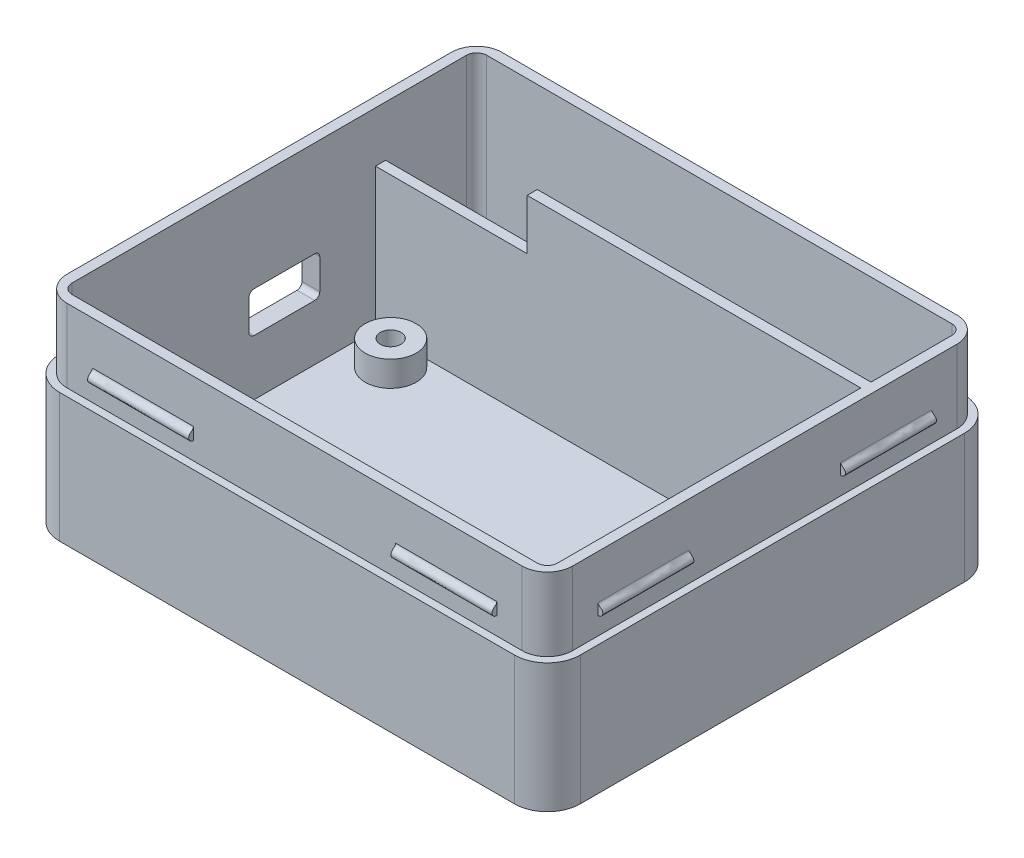
from build123d import *

# Parameters (mm, degrees)
ESQUISSE1_W             = 100
ESQUISSE1_H             = 66
BOSS_EXTRU_1_DEPTH      = 40
COQUE1_T                = -2
BOSS_EXTRU_2_DEPTH      = 40
ESQUISSE3_W             = 96
ESQUISSE3_H             = 18
BOSS_EXTRU_3_DEPTH      = 2
CONG_1_R                = 2
CONG_2_R                = 5
BOSS_EXTRU_4_START      = -10
BOSS_EXTRU_4_DEPTH      = 80
BOSS_EXTRU_5_START      = -10
BOSS_EXTRU_5_DEPTH      = 66
ESQUISSE6_W             = 30
ESQUISSE6_H             = 10
ENL_V_MAT_EXTRU_1_DEPTH = 5
ESQUISSE7_R             = 5.05
ESQUISSE7_R_2           = 5
BOSS_EXTRU_6_DEPTH      = 5
ESQUISSE8_R             = 2.05
ENL_V_MAT_EXTRU_2_DEPTH = 6.5
BOSS_EXTRU_7_START      = -25.5
BOSS_EXTRU_7_DEPTH      = 25.5
ESQUISSE11_W            = 14
ESQUISSE11_H            = 8
ENL_V_MAT_EXTRU_4_DEPTH = 10
CONG_3_R                = 1
ENL_V_START             = -11
ESQUISSE13_W            = 15.255794969
ESQUISSE13_H            = 30
ESQUISSE13_W_2          = 19.187526393
ESQUISSE13_W_3          = 40
ESQUISSE13_H_2          = 22.475627791
ESQUISSE13_H_3          = 22.031692389
ENL_V_MAT_EXTRU_6_DEPTH = 2.407546


with BuildPart() as part:
    # Esquisse1 → Boss.-Extru.1 (new body)
    with BuildSketch(Plane(origin=(0, 0, 0), x_dir=(1, 0, 0), z_dir=(0, 1, 0))):
        Rectangle(ESQUISSE1_W, ESQUISSE1_H)
    extrude(amount=BOSS_EXTRU_1_DEPTH)

    # Coque1
    coque1_openings = [part.faces().sort_by_distance(p)[0] for p in [
        (0, 40, 0),
    ]]
    offset(amount=COQUE1_T, openings=coque1_openings, kind=Kind.INTERSECTION)

    # Esquisse2 → Boss.-Extru.2 (add)
    with BuildSketch(Plane.XZ):
        Polygon((-50, -33), (-50, -53), (50, -53), (50, -33), (48, -33), (48, -51), (-48, -51), (-48, -33), align=None)
    extrude(amount=-BOSS_EXTRU_2_DEPTH)

    # Esquisse3 → Boss.-Extru.3 (add)
    with BuildSketch(Plane.XZ):
        with Locations((0, -42)):
            Rectangle(ESQUISSE3_W, ESQUISSE3_H)
    extrude(amount=-BOSS_EXTRU_3_DEPTH)

    # Congé1
    cong_1_edges = [part.edges().sort_by_distance(p)[0] for p in [
        (48, 21, 31),
        (-48, 21, 31),
        (-48, 21, -51),
        (48, 21, -51),
    ]]
    fillet(cong_1_edges, radius=CONG_1_R)

    # Congé2
    cong_2_edges = [part.edges().sort_by_distance(p)[0] for p in [
        (50, 20, -53),
        (-50, 20, -53),
        (50, 20, 33),
        (-50, 20, 33),
    ]]
    fillet(cong_2_edges, radius=CONG_2_R)

    # Esquisse4 → Boss.-Extru.4 (add)
    with BuildSketch(Plane(origin=(50, 0, 0), x_dir=(0, 0, -1), z_dir=(1, 0, 0)).offset(BOSS_EXTRU_4_START)):
        with BuildLine():
            add(Edge.make_bspline(
                [(-33.18068568, 30.983540891), (-33.200458758, 30.96131094), (-33.363431499, 30.798331001), (-33.767642681, 30.550383894), (-33.920207773, 30.167024248), (-33.940361593, 30)],
                knots=[0.143259485, 0.143259485, 0.143259485, 0.143259485, 0.176064933, 0.395847239, 0.557376167, 0.557376167, 0.557376167, 0.557376167], degree=3))
            Line((-33.940361593, 30), (-33, 30))
            Line((-33, 30), (-33, 31))
            ThreePointArc((-33, 31), (-33.090716891, 30.995876722), (-33.18068568, 30.983540891))
        make_face()
        with BuildLine():
            Line((-33, 30), (-33.940361593, 30))
            add(Edge.make_bspline(
                [(-33.940361593, 30), (-33.965852576, 29.788744152), (-33.920193726, 29.570085219), (-33.793139685, 29.390960231)],
                knots=[0.557376167, 0.557376167, 0.557376167, 0.557376167, 0.761681416, 0.761681416, 0.761681416, 0.761681416], degree=3))
            ThreePointArc((-33.793139685, 29.390960231), (-33.668435122, 29.256229547), (-33.521201899, 29.146566593))
            add(Edge.make_bspline(
                [(-33.521201899, 29.146566593), (-33.383555588, 29.067558812), (-33.210703446, 29.014663383), (-33, 29)],
                knots=[0.869901718, 0.869901718, 0.869901718, 0.869901718, 1, 1, 1, 1], degree=3))
            Line((-33, 29), (-33, 30))
        make_face()
        with BuildLine():
            add(Edge.make_bspline(
                [(-33, 31.407545579), (-33.034562351, 31.197957452), (-33.094337797, 31.080617796), (-33.18068568, 30.983540891)],
                knots=[0, 0, 0, 0, 0.143259485, 0.143259485, 0.143259485, 0.143259485], degree=3))
            ThreePointArc((-33.18068568, 30.983540891), (-33.090716891, 30.995876722), (-33, 31))
            Line((-33, 31), (-33, 31.407545579))
        make_face()
    boss_extru_4 = extrude(amount=-BOSS_EXTRU_4_DEPTH)

    # Symétrie1: Boss.-Extru.4 across plane
    add(boss_extru_4.mirror(Plane(origin=(0, 0, -10), x_dir=(1, 0, 0), z_dir=(0, 0, -1))))

    # Esquisse5 → Boss.-Extru.5 (add)
    with BuildSketch(Plane(origin=(0, 0, -53), x_dir=(-1, 0, 0), z_dir=(0, 0, -1)).offset(BOSS_EXTRU_5_START)):
        with BuildLine():
            Line((50, 31), (50, 30))
            Line((50, 30), (50.954744397, 30))
            add(Edge.make_bspline(
                [(50.071227775, 30.997460076), (50.105831951, 30.947860896), (50.333105005, 30.754205677), (50.733359691, 30.483317374), (50.928074611, 30.14722169), (50.952688369, 30.013748506), (50.954744397, 30)],
                knots=[0.094412214, 0.094412214, 0.094412214, 0.094412214, 0.17575087, 0.513306361, 0.658257517, 0.674363201, 0.674363201, 0.674363201, 0.674363201], degree=3))
            ThreePointArc((50.071227775, 30.997460076), (50.035636523, 30.999364817), (50, 31))
        make_face()
        with BuildLine():
            Line((50.954744397, 30), (50, 30))
            Line((50, 30), (50, 29))
            add(Edge.make_bspline(
                [(50.614699385, 29.211238524), (50.471700803, 29.109564191), (50.273252948, 29.031064982), (50, 29)],
                knots=[0.902878806, 0.902878806, 0.902878806, 0.902878806, 1, 1, 1, 1], degree=3))
            ThreePointArc((50.614699385, 29.211238524), (50.766229844, 29.357433407), (50.883789944, 29.53211611))
            add(Edge.make_bspline(
                [(50.954744397, 30), (50.958901429, 29.972202239), (50.969579307, 29.846467876), (50.946629378, 29.667882673), (50.883789944, 29.53211611)],
                knots=[0.674363201, 0.674363201, 0.674363201, 0.674363201, 0.706926881, 0.813448737, 0.813448737, 0.813448737, 0.813448737], degree=3))
        make_face()
        with BuildLine():
            Line((50, 31.237869204), (50, 31))
            ThreePointArc((50, 31), (50.035636523, 30.999364817), (50.071227775, 30.997460076))
            add(Edge.make_bspline(
                [(50, 31.237869204), (50.003730574, 31.128765035), (50.031061672, 31.05503133), (50.071227775, 30.997460076)],
                knots=[0, 0, 0, 0, 0.094412214, 0.094412214, 0.094412214, 0.094412214], degree=3))
        make_face()
    boss_extru_5 = extrude(amount=-BOSS_EXTRU_5_DEPTH)

    # Symétrie2: Boss.-Extru.5 across plane
    add(boss_extru_5.mirror(Plane(origin=(0, 0, 0), x_dir=(0, 0, 1), z_dir=(1, 0, 0))))

    # Esquisse6 → Enlèv. mat.-Extru.1 (cut)
    with BuildSketch(Plane.XY.offset(-31)):
        with Locations((-33, 35)):
            Rectangle(ESQUISSE6_W, ESQUISSE6_H)
    extrude(amount=-ENL_V_MAT_EXTRU_1_DEPTH, mode=Mode.SUBTRACT)

    # Esquisse7 → Boss.-Extru.6 (add)
    with BuildSketch(Plane(origin=(0, 2, 0), x_dir=(1, 0, 0), z_dir=(0, 1, 0))):
        with Locations((-40, 26)):
            Circle(ESQUISSE7_R)
        with Locations(Location((-40, -23, 0), (0, 0, 90))):
            Circle(ESQUISSE7_R_2)
        with Locations(Location((32, -17, 0), (0, 0, 90))):
            Circle(ESQUISSE7_R_2)
        with Locations(Location((32, 11, 0), (0, 0, 90))):
            Circle(ESQUISSE7_R_2)
    extrude(amount=BOSS_EXTRU_6_DEPTH)

    # Esquisse8 → Enlèv. mat.-Extru.2 (cut)
    with BuildSketch(Plane(origin=(0, 7, 0), x_dir=(1, 0, 0), z_dir=(0, 1, 0))):
        with Locations(Location((-40, 26, 0), (0, 0, 270))):
            Circle(ESQUISSE8_R)
        with Locations(Location((-40, -23, 0), (0, 0, 270))):
            Circle(ESQUISSE8_R)
        with Locations(Location((32, 11, 0), (0, 0, 270))):
            Circle(ESQUISSE8_R)
        with Locations(Location((32, -17, 0), (0, 0, 270))):
            Circle(ESQUISSE8_R)
    extrude(amount=-ENL_V_MAT_EXTRU_2_DEPTH, mode=Mode.SUBTRACT)

    # Esquisse10 → Boss.-Extru.7 (add)
    with BuildSketch(Plane.XZ.offset(BOSS_EXTRU_7_START)):
        with BuildLine():
            Line((-51.5, 28), (-51.5, -48))
            ThreePointArc((-51.5, -48), (-49.596194078, -52.596194078), (-45, -54.5))
            Line((-45, -54.5), (45, -54.5))
            ThreePointArc((45, -54.5), (49.596194078, -52.596194078), (51.5, -48))
            Line((51.5, -48), (51.5, 28))
            ThreePointArc((51.5, 28), (49.596194078, 32.596194078), (45, 34.5))
            Line((45, 34.5), (-45, 34.5))
            ThreePointArc((-45, 34.5), (-49.596194078, 32.596194078), (-51.5, 28))
        make_face()
        with BuildLine():
            Line((50, 28), (50, -48))
            ThreePointArc((50, -48), (48.535533906, -51.535533906), (45, -53))
            Line((45, -53), (-45, -53))
            ThreePointArc((-45, -53), (-48.535533906, -51.535533906), (-50, -48))
            Line((-50, -48), (-50, 28))
            ThreePointArc((-50, 28), (-48.535533906, 31.535533906), (-45, 33))
            Line((-45, 33), (45, 33))
            ThreePointArc((45, 33), (48.535533906, 31.535533906), (50, 28))
        make_face(mode=Mode.SUBTRACT)
    extrude(amount=BOSS_EXTRU_7_DEPTH)

    # Esquisse11 → Enlèv. mat.-Extru.4 (cut)
    with BuildSketch(Plane(origin=(-48, 0, 0), x_dir=(0, 0, -1), z_dir=(1, 0, 0))):
        with Locations((12.975, 17)):
            Rectangle(ESQUISSE11_W, ESQUISSE11_H)
    extrude(amount=-ENL_V_MAT_EXTRU_4_DEPTH, mode=Mode.SUBTRACT)

    # Congé3
    cong_3_edges = [part.edges().sort_by_distance(p)[0] for p in [
        (-49.75, 21, -19.975),
        (-49.75, 13, -19.975),
        (-49.75, 13, -5.975),
        (-49.75, 21, -5.975),
    ]]
    fillet(cong_3_edges, radius=CONG_3_R)

    # Esquisse13 → Enlèv. mat.-Extru.6 (cut)
    with BuildSketch(Plane(origin=(0, 40, 0), x_dir=(1, 0, 0), z_dir=(0, 1, 0)).offset(ENL_V_START)):
        with Locations((-57.627897485, 10)):
            Rectangle(ESQUISSE13_W, ESQUISSE13_H)
        with Locations((59.593763196, 10)):
            Rectangle(ESQUISSE13_W_2, ESQUISSE13_H)
        with Locations((0, -44.237813895)):
            Rectangle(ESQUISSE13_W_3, ESQUISSE13_H_2)
        with Locations((0, 64.015846194)):
            Rectangle(ESQUISSE13_W_3, ESQUISSE13_H_3)
    extrude(amount=ENL_V_MAT_EXTRU_6_DEPTH, mode=Mode.SUBTRACT)


solid = part.part
